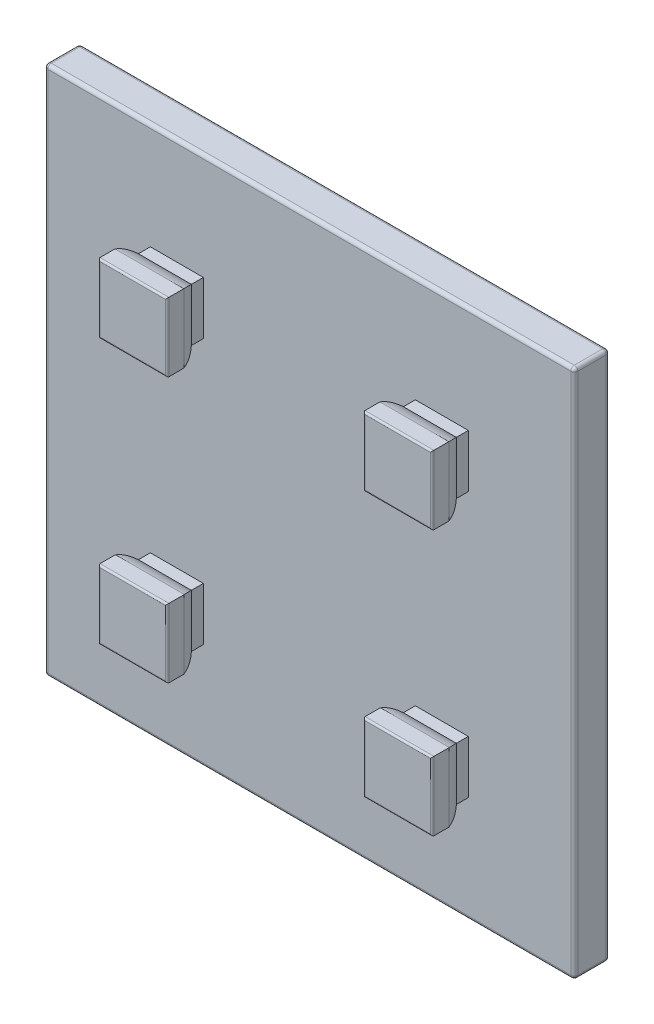
from build123d import *

# Parameters (mm, degrees)
SKETCH_1_W          = 30
SKETCH_1_H          = 30
EXTRUDE_1_DEPTH     = 2
SKETCH_2_W          = 3
SKETCH_2_H          = 3
EXTRUDE_2_DEPTH     = 1
EXTRUDE_START       = 5
EXTRUDE_3_DEPTH     = 5
CUT_EXTRUDE_1_DEPTH = 29.793271784
FILLET_1_R          = 0.1
FILLET_2_R          = 0.2


with BuildPart() as part:
    # 草图1 → 凸台-拉伸1 (new body)
    with BuildSketch(Plane.XY):
        Rectangle(SKETCH_1_W, SKETCH_1_H)
    extrude(amount=-EXTRUDE_1_DEPTH)

    # 草图2 → 凸台-拉伸2 (add)
    with BuildSketch(Plane.XY):
        with Locations((-7.5, -7.5)):
            Rectangle(SKETCH_2_W, SKETCH_2_H)
        with Locations((7.5, -7.5)):
            Rectangle(SKETCH_2_W, SKETCH_2_H)
    extrude_2 = extrude(amount=EXTRUDE_2_DEPTH)

    # 草图3 → 凸台-拉伸3 (add)
    with BuildSketch(Plane.XZ.offset(EXTRUDE_START)):
        with BuildLine():
            Line((-9.45, 2.5), (-5.55, 2.5))
            Line((-5.55, 2.5), (-5.55, 1.555590279))
            ThreePointArc((-5.55, 1.555590279), (-5.719957697, 1.088161527), (-6, 0.677124344))
            Line((-6, 0.677124344), (-9, 0.677124344))
            ThreePointArc((-9, 0.677124344), (-9.280042303, 1.088161527), (-9.45, 1.555590279))
            Line((-9.45, 1.555590279), (-9.45, 2.5))
        make_face()
        with BuildLine():
            Line((9, 0.677124344), (6, 0.677124344))
            ThreePointArc((6, 0.677124344), (5.719957697, 1.088161527), (5.55, 1.555590279))
            Line((5.55, 1.555590279), (5.55, 2.5))
            Line((5.55, 2.5), (9.45, 2.5))
            Line((9.45, 2.5), (9.45, 1.555590279))
            ThreePointArc((9.45, 1.555590279), (9.280042303, 1.088161527), (9, 0.677124344))
        make_face()
    extrude_3 = extrude(amount=EXTRUDE_3_DEPTH)

    # 草图4 → 切除-拉伸1 (cut, through all)
    with BuildSketch(Plane.ZY.offset(9.45)):
        with BuildLine():
            Line((2.5, -5.5530417), (1.528231876, -5.556437591))
            ThreePointArc((1.528231876, -5.556437591), (1.075676747, -5.72640858), (0.677124344, -6))
            Line((0.677124344, -6), (0.677124344, -5))
            Line((0.677124344, -5), (2.5, -5))
            Line((2.5, -5), (2.5, -5.5530417))
        make_face()
        with BuildLine():
            Line((0.677124344, -10), (2.5, -10))
            Line((2.5, -10), (2.5, -9.45))
            Line((2.5, -9.45), (1.555590279, -9.45))
            ThreePointArc((1.555590279, -9.45), (1.088161527, -9.280042303), (0.677124344, -9))
            Line((0.677124344, -9), (0.677124344, -10))
        make_face()
    cut_extrude_1 = extrude(amount=-CUT_EXTRUDE_1_DEPTH, mode=Mode.SUBTRACT)

    # 镜向1: 凸台-拉伸2, 凸台-拉伸3, 切除-拉伸1 across plane
    add(extrude_2.mirror(Plane.ZX))
    add(extrude_3.mirror(Plane.ZX))
    add(cut_extrude_1.mirror(Plane.ZX), mode=Mode.SUBTRACT)

    # 圆角1
    fillet_1_edges = [part.edges().sort_by_distance(p)[0] for p in [
        (-5.55, -7.50152085, 2.5),
        (-9.45, -7.50152085, 2.5),
        (5.55, -7.50152085, 2.5),
        (9.45, -7.50152085, 2.5),
        (7.5, -9.45, 2.5),
        (-7.5, -9.45, 2.5),
        (7.5, 5.5530417, 2.5),
        (-7.5, 5.5530417, 2.5),
        (-5.55, 7.50152085, 2.5),
        (-9.45, 7.50152085, 2.5),
        (9.45, 7.50152085, 2.5),
        (5.55, 7.50152085, 2.5),
        (7.5, 9.45, 2.5),
        (-7.5, 9.45, 2.5),
        (7.5, -5.5530417, 2.5),
        (-7.5, -5.5530417, 2.5),
    ]]
    fillet(fillet_1_edges, radius=FILLET_1_R)

    # 圆角2
    fillet_2_edges = [part.edges().sort_by_distance(p)[0] for p in [
        (15, 0, -2),
        (0, 15, -2),
        (-15, 0, -2),
        (0, 15, 0),
        (15, 0, 0),
        (0, -15, 0),
        (-15, 0, 0),
        (0, -15, -2),
        (-15, 15, -1),
        (15, 15, -1),
        (15, -15, -1),
        (-15, -15, -1),
    ]]
    fillet(fillet_2_edges, radius=FILLET_2_R)


solid = part.part
